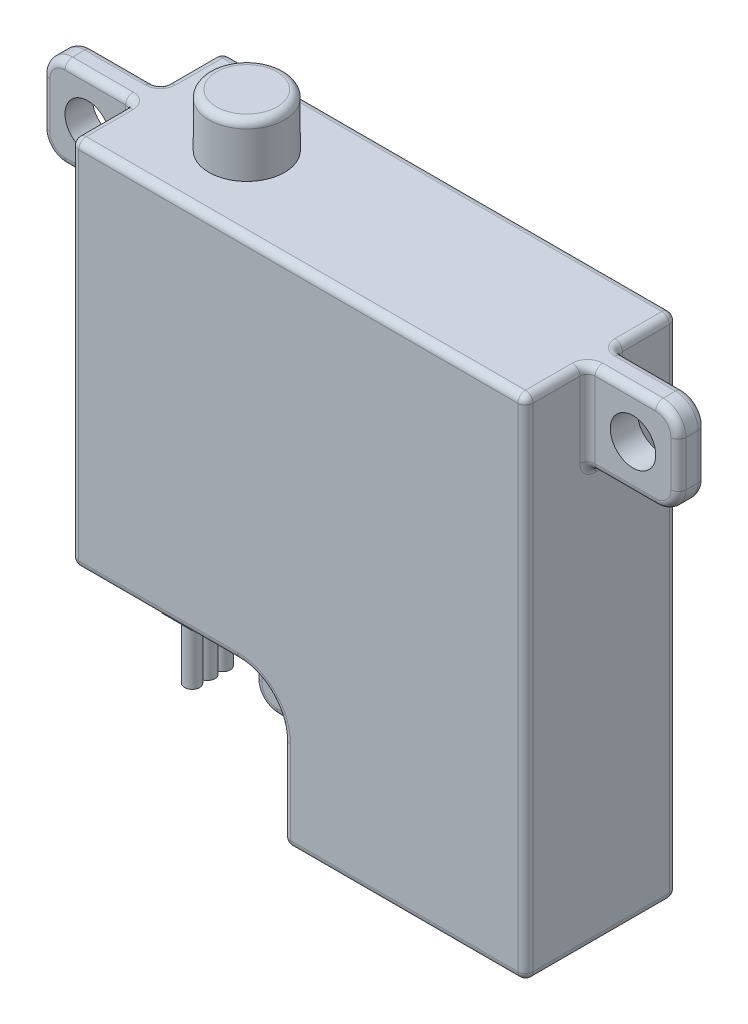
from build123d import *

# Parameters (mm, degrees)
BOSS_EXTRUDE1_DEPTH = 10
SKETCH2_W           = 1.8
SKETCH2_H           = 6
BOSS_EXTRUDE2_DEPTH = 6
SKETCH3_W           = 1.8
SKETCH3_H           = 6
BOSS_EXTRUDE3_DEPTH = 6
SKETCH4_W           = 1.8
SKETCH4_H           = 6
BOSS_EXTRUDE4_DEPTH = 6
SKETCH5_R           = 1.5
CUT_EXTRUDE2_DEPTH  = 6
FILLET1_R           = 0.5
SKETCH6_R           = 2.5
BOSS_EXTRUDE5_DEPTH = 3.5
FILLET2_R           = 0.5
SKETCH7_W           = 3
SKETCH7_H           = 5
BOSS_EXTRUDE6_DEPTH = 0.75
SKETCH9_W           = 2
SKETCH9_H           = 4
BOSS_EXTRUDE7_DEPTH = 2
SKETCH11_R          = 0.5
BOSS_EXTRUDE8_DEPTH = 4


with BuildPart() as part:
    # Sketch1 → Boss-Extrude1 (new body)
    with BuildSketch(Plane.XY):
        with BuildLine():
            Line((0, 0), (16, 0))
            Line((16, 0), (16, 33.5))
            Line((16, 33.5), (-14, 33.5))
            Line((-14, 33.5), (-14, 9))
            Line((-14, 9), (-3, 9))
            ThreePointArc((-3, 9), (-0.878679656, 8.121320344), (0, 6))
            Line((0, 6), (0, 0))
        make_face()
    extrude(amount=BOSS_EXTRUDE1_DEPTH)

    # Sketch2 → Boss-Extrude2 (add)
    with BuildSketch(Plane.ZY.offset(14)):
        with Locations((5, 30.5)):
            Rectangle(SKETCH2_W, SKETCH2_H)
    extrude(amount=BOSS_EXTRUDE2_DEPTH)

    # Sketch3 → Boss-Extrude3 (add)
    with BuildSketch(Plane(origin=(16, 0, 0), x_dir=(0, 0, -1), z_dir=(1, 0, 0))):
        with Locations((-5, 30.5)):
            Rectangle(SKETCH3_W, SKETCH3_H)
    extrude(amount=BOSS_EXTRUDE3_DEPTH)

    # Sketch4 → Boss-Extrude4 (add)
    with BuildSketch(Plane.ZY):
        with Locations((5, 6)):
            Rectangle(SKETCH4_W, SKETCH4_H)
    extrude(amount=BOSS_EXTRUDE4_DEPTH)

    # Sketch5 → Cut-Extrude2 (cut)
    with BuildSketch(Plane.XY.offset(5.9)):
        with BuildLine():
            ThreePointArc((-6, 4.5), (-5.560660172, 3.439339828), (-4.5, 3))
            Line((-4.5, 3), (-6, 3))
            Line((-6, 3), (-6, 4.5))
        make_face()
        with Locations((-3, 6)):
            Circle(SKETCH5_R)
        with BuildLine():
            ThreePointArc((-18.5, 27.5), (-19.560660172, 27.939339828), (-20, 29))
            Line((-20, 29), (-20, 27.5))
            Line((-20, 27.5), (-18.5, 27.5))
        make_face()
        with BuildLine():
            Line((-20, 33.5), (-20, 32))
            ThreePointArc((-20, 32), (-19.560660172, 33.060660172), (-18.5, 33.5))
            Line((-18.5, 33.5), (-20, 33.5))
        make_face()
        with Locations((-17, 30.5)):
            Circle(SKETCH5_R)
        with Locations((19, 30.5)):
            Circle(SKETCH5_R)
        with BuildLine():
            Line((20.5, 33.5), (22, 33.5))
            Line((22, 33.5), (22, 32))
            ThreePointArc((22, 32), (21.560660172, 33.060660172), (20.5, 33.5))
        make_face()
        with BuildLine():
            ThreePointArc((20.5, 27.5), (21.560660172, 27.939339828), (22, 29))
            Line((22, 29), (22, 27.5))
            Line((22, 27.5), (20.5, 27.5))
        make_face()
    extrude(amount=-CUT_EXTRUDE2_DEPTH, mode=Mode.SUBTRACT)

    # Fillet1
    fillet1_edges = [part.edges().sort_by_distance(p)[0] for p in [
        (21.560660172, 27.939339828, 5.9),
        (21.560660172, 27.939339828, 4.1),
        (0, 3, 0),
        (-4.5, 6, 4.1),
        (-4.5, 6, 5.9),
        (-19.560660172, 27.939339828, 5.9),
        (-19.560660172, 27.939339828, 4.1),
        (-19.560660172, 33.060660172, 4.1),
        (-19.560660172, 33.060660172, 5.9),
        (-5.560660172, 3.439339828, 5.9),
        (-5.560660172, 3.439339828, 4.1),
        (-14, 9, 5),
        (16, 16.75, 10),
        (-14, 33.5, 7.95),
        (16, 33.5, 7.95),
        (16, 0, 5),
        (0, 0, 5),
        (1, 33.5, 10),
        (-14, 21.25, 10),
        (-14, 33.5, 2.05),
        (-14, 30.5, 4.1),
        (-8.5, 9, 10),
        (-14, 27.5, 5),
        (-14, 30.5, 5.9),
        (-0.878679656, 8.121320344, 10),
        (16, 33.5, 2.05),
        (16, 30.5, 5.9),
        (16, 27.5, 5),
        (16, 30.5, 4.1),
        (-0.878679656, 8.121320344, 5.9),
        (0, 3, 10),
        (-0.878679656, 8.121320344, 4.1),
        (-4.5, 9, 4.1),
        (0, 4.5, 4.1),
        (0, 4.5, 5.9),
        (0, 3, 5),
        (-4.5, 9, 5.9),
        (-6, 6.75, 4.1),
        (-6, 9, 5),
        (-6, 6.75, 5.9),
        (-2.25, 3, 5.9),
        (-2.25, 3, 4.1),
        (22, 30.5, 5.9),
        (22, 30.5, 4.1),
        (18.25, 33.5, 4.1),
        (18.25, 27.5, 4.1),
        (-0.878679656, 8.121320344, 0),
        (18.25, 27.5, 5.9),
        (18.25, 33.5, 5.9),
        (-8.5, 9, 0),
        (-20, 30.5, 4.1),
        (-20, 30.5, 5.9),
        (-16.25, 33.5, 5.9),
        (-16.25, 27.5, 5.9),
        (-14, 21.25, 0),
        (-16.25, 27.5, 4.1),
        (-16.25, 33.5, 4.1),
        (1, 33.5, 0),
        (8, 0, 10),
        (21.560660172, 33.060660172, 4.1),
        (16, 16.75, 0),
        (21.560660172, 33.060660172, 5.9),
        (8, 0, 0),
    ]]
    fillet(fillet1_edges, radius=FILLET1_R)

    # Sketch6 → Boss-Extrude5 (add)
    with BuildSketch(Plane(origin=(0, 33.5, 0), x_dir=(1, 0, 0), z_dir=(0, 1, 0))):
        with Locations((-7.4, -5)):
            Circle(SKETCH6_R)
    extrude(amount=BOSS_EXTRUDE5_DEPTH)

    # Fillet2
    fillet2_edges = [part.edges().sort_by_distance(p)[0] for p in [
        (-9.9, 37, 5),
    ]]
    fillet(fillet2_edges, radius=FILLET2_R)

    # Sketch7 → Boss-Extrude6 (add)
    with BuildSketch(Plane.XZ.offset(-9)):
        with Locations((-10, 5)):
            Rectangle(SKETCH7_W, SKETCH7_H)
    extrude(amount=BOSS_EXTRUDE6_DEPTH)

    # Sketch9 → Boss-Extrude7 (add)
    with BuildSketch(Plane.XZ.offset(-8.25)):
        with Locations((-10, 5)):
            Rectangle(SKETCH9_W, SKETCH9_H)
    extrude(amount=BOSS_EXTRUDE7_DEPTH)

    # Sketch11 → Boss-Extrude8 (add)
    with BuildSketch(Plane.XZ.offset(-6.25)):
        with Locations(Location((-10, 6.01, 0), (0, 0, 90))):
            Circle(SKETCH11_R)
        with Locations(Location((-10, 5, 0), (0, 0, 90))):
            Circle(SKETCH11_R)
        with Locations(Location((-10, 3.99, 0), (0, 0, 90))):
            Circle(SKETCH11_R)
    extrude(amount=BOSS_EXTRUDE8_DEPTH)


solid = part.part
